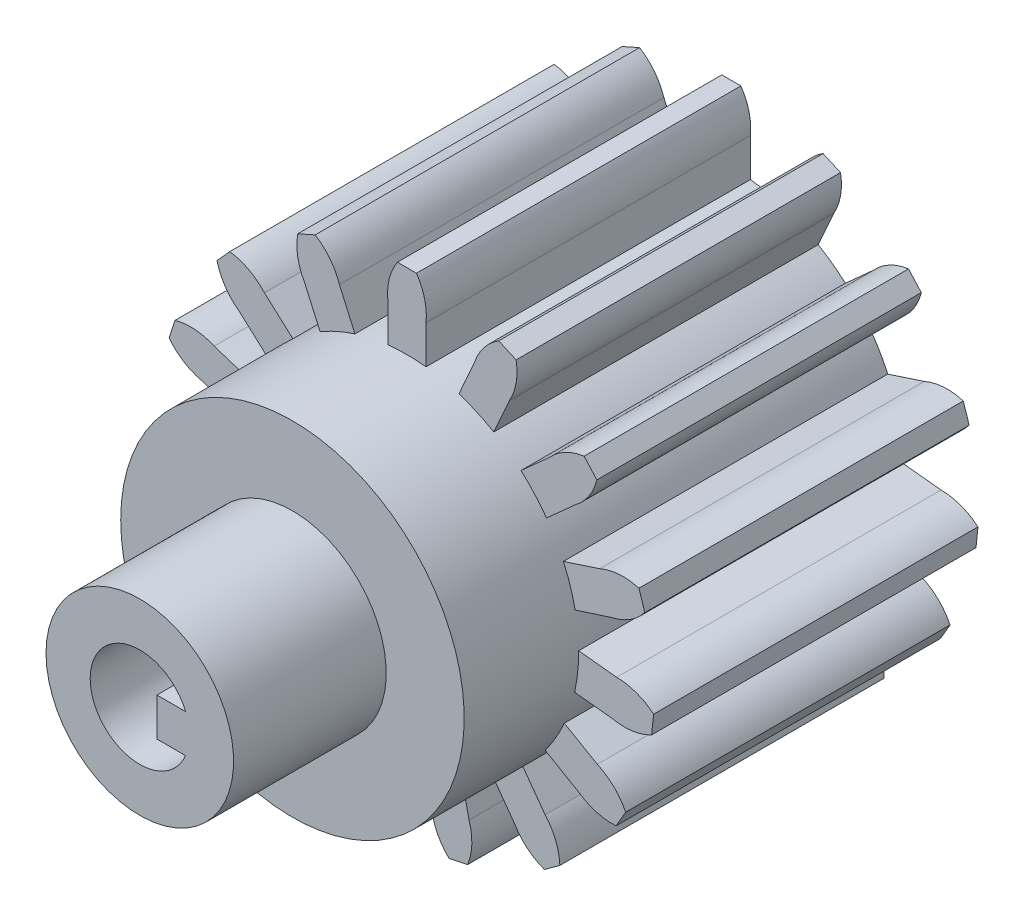
from build123d import *

# Parameters (mm, degrees)
SKETCH1_R                    = 9
SKETCH1_R_2                  = 2.6
BOSS_EXTRUDE1_DEPTH          = 36
SKETCH5_W                    = 5
SKETCH5_H                    = 4.08502449
SKETCH5_W_2                  = 8
BOSS_EXTRUDE2_DEPTH          = 22
SKETCH7_W                    = 5
SKETCH7_H                    = 4.653899232
CUT_REVOLVE2_ANGLE           = 90
CUT_REVOLVE2_OTHER_WAY_ANGLE = 90
CIRPATTERN1_COUNT            = 15
SKETCH13_W                   = 5
SKETCH13_H                   = 16.616445935
SKETCH17_R                   = 2
CUT_EXTRUDE1_DEPTH           = 10
BOSS_EXTRUDE3_DEPTH          = 31


with BuildPart() as part:
    # Sketch1 → Boss-Extrude1 (new body)
    with BuildSketch(Plane.XY):
        Circle(SKETCH1_R)
        Circle(SKETCH1_R_2, mode=Mode.SUBTRACT)
    extrude(amount=BOSS_EXTRUDE1_DEPTH)

    # Sketch5 → Cut-Revolve1 (revolve, cut)
    with BuildSketch(Plane(origin=(0, 0, 0), x_dir=(0, 0, -1), z_dir=(1, 0, 0)), mode=Mode.PRIVATE) as cut_revolve1_sk:
        with Locations((-2.5, 6.957487755)):
            Rectangle(SKETCH5_W, SKETCH5_H)
        with Locations((-32, 6.957487755)):
            Rectangle(SKETCH5_W_2, SKETCH5_H)
    revolve(cut_revolve1_sk.sketch.rotate(Axis((0, 0, 0), (0, 0, 1)), 90), axis=Axis((0, 0, 0), (0, 0, 1)), mode=Mode.SUBTRACT)

    # Sketch6 → Boss-Extrude2 (add)
    with BuildSketch(Plane.XY):
        with BuildLine():
            Line((-1, 8.94427191), (-1, 10.94427191))
            ThreePointArc((-1, 10.94427191), (-0.927189817, 11.988569364), (-0.5, 12.94427191))
            Line((-0.5, 12.94427191), (0.5, 12.94427191))
            ThreePointArc((0.5, 12.94427191), (0.927189817, 11.988569364), (1, 10.94427191))
            Line((1, 10.94427191), (1, 8.94427191))
            Line((1, 8.94427191), (-1, 8.94427191))
        make_face()
    boss_extrude2 = extrude(amount=BOSS_EXTRUDE2_DEPTH)

    # Sketch7 → Cut-Revolve2 (revolve, cut)
    with BuildSketch(Plane(origin=(0, 0, 0), x_dir=(0, 0, -1), z_dir=(1, 0, 0))):
        with Locations((-2.5, 11.271221526)):
            Rectangle(SKETCH7_W, SKETCH7_H)
    revolve(axis=Axis((0, 8.94427191, 5), (0, 0, -1)), revolution_arc=CUT_REVOLVE2_ANGLE, mode=Mode.SUBTRACT)

    # Sketch7 → Cut-Revolve2 other way (revolve, cut)
    with BuildSketch(Plane(origin=(0, 0, 0), x_dir=(0, 0, -1), z_dir=(1, 0, 0))):
        with Locations((-2.5, 11.271221526)):
            Rectangle(SKETCH7_W, SKETCH7_H)
    revolve(axis=Axis((0, 8.94427191, 5), (0, 0, 1)), revolution_arc=CUT_REVOLVE2_OTHER_WAY_ANGLE, mode=Mode.SUBTRACT)

    # CirPattern1: Boss-Extrude2 ×15 about axis
    cirpattern1_axis = Axis((0, 0, 0), (0, 0, 1))
    for i in range(1, CIRPATTERN1_COUNT):
        add(boss_extrude2.rotate(cirpattern1_axis, i * 360 / CIRPATTERN1_COUNT))

    # Sketch13 → Cut-Revolve6 (revolve, cut)
    with BuildSketch(Plane(origin=(0, 0, 0), x_dir=(0, 0, -1), z_dir=(1, 0, 0)), mode=Mode.PRIVATE) as cut_revolve6_sk:
        with Locations((-2.5, 8.308222968)):
            Rectangle(SKETCH13_W, SKETCH13_H)
    revolve(cut_revolve6_sk.sketch.rotate(Axis((0, 0, 25.578402878), (0, 0, -1)), 270), axis=Axis((0, 0, 25.578402878), (0, 0, -1)), mode=Mode.SUBTRACT)

    # Sketch17 → Cut-Extrude1 (cut)
    with BuildSketch(Plane(origin=(0, 0, 0), x_dir=(1, 0, 0), z_dir=(0, 1, 0))):
        with Locations(Location((-0.128741976, -25.11123185, 0), (0, 0, 270))):
            Circle(SKETCH17_R)
    extrude(amount=-CUT_EXTRUDE1_DEPTH, mode=Mode.SUBTRACT)

    # Sketch19 → Boss-Extrude3 (add)
    with BuildSketch(Plane.XY.offset(36)):
        Polygon((2.4, 1), (3.9, 1), (3.9, -1), (2.4, -1), (0.9, -1), (0.9, 1), align=None)
    extrude(amount=-BOSS_EXTRUDE3_DEPTH)


solid = part.part
